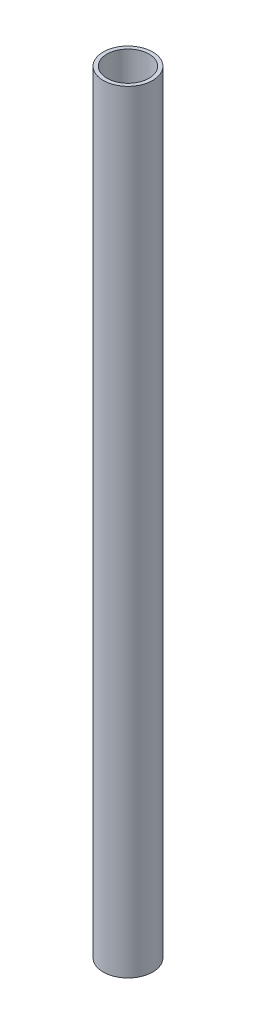
from build123d import *

# Parameters (mm, degrees)
SKETCH_1_R      = 16
SKETCH_1_R_2    = 13.6
EXTRUDE_1_DEPTH = 500


with BuildPart() as part:
    # 草图1 → 凸台-拉伸1 (new body)
    with BuildSketch(Plane(origin=(0, 0, 0), x_dir=(1, 0, 0), z_dir=(0, 1, 0))):
        with Locations(Location((0, 0, 0), (0, 0, 270))):
            Circle(SKETCH_1_R)
        with Locations(Location((0, 0, 0), (0, 0, 270))):
            Circle(SKETCH_1_R_2, mode=Mode.SUBTRACT)
    extrude(amount=EXTRUDE_1_DEPTH)


solid = part.part
